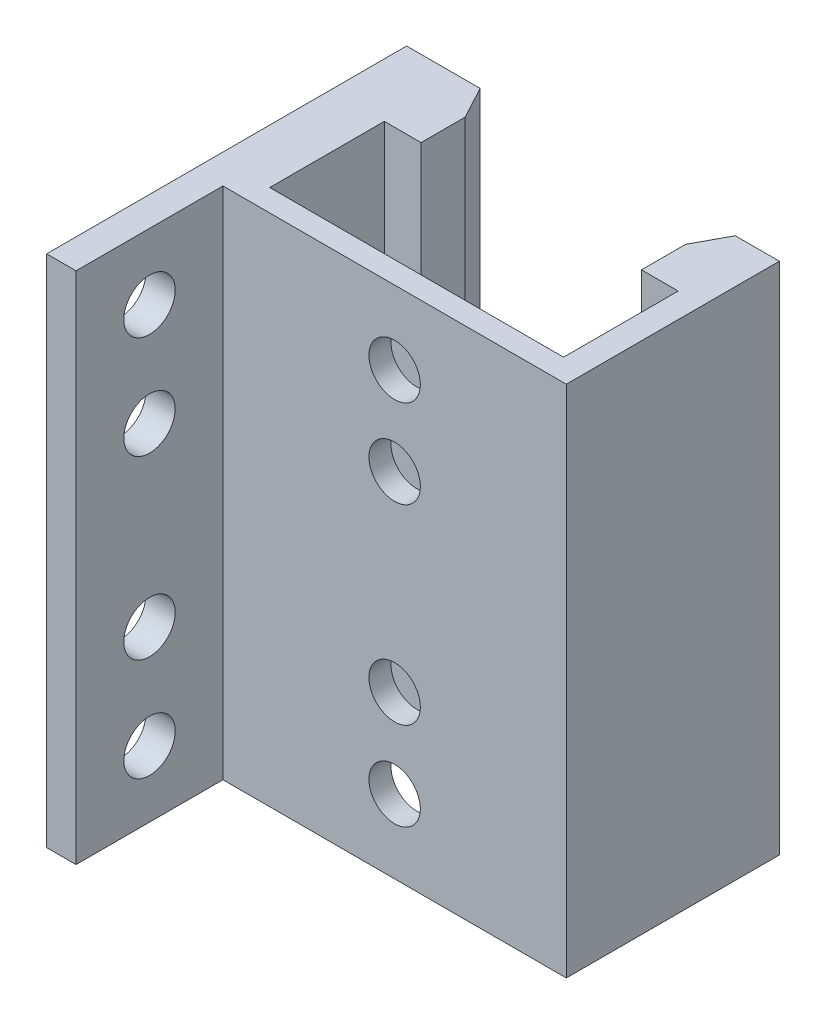
from build123d import *

# Parameters (mm, degrees)
BOSS_EXTRUDE1_DEPTH = 35
SKETCH2_R           = 1.75
CUT_EXTRUDE1_DEPTH  = 10
MOUNTING_WING_DEPTH = 2
SKETCH5_R           = 1.75
CUT_EXTRUDE2_DEPTH  = 3.5


with BuildPart() as part:
    # Sketch1 → Boss-Extrude1 (new body)
    with BuildSketch(Plane(origin=(0, 0, 0), x_dir=(1, 0, 0), z_dir=(0, 1, 0))):
        Polygon((-11.683800623, 0), (11.683800623, 0), (11.683800623, 14.5), (8.683800623, 14.5), (7.5, 12.3), (7.5, 9.3), (10, 9.3), (10, 1.5), (-10, 1.5), (-10, 9.3), (-7.5, 9.3), (-7.5, 12.3), (-8.683800623, 14.5), (-11.683800623, 14.5), align=None)
    extrude(amount=BOSS_EXTRUDE1_DEPTH)

    # Sketch2 → Cut-Extrude1 (cut)
    with BuildSketch(Plane.XY):
        with Locations((0, 5)):
            Circle(SKETCH2_R)
        with Locations((0, 24)):
            Circle(SKETCH2_R)
        with Locations((0, 11)):
            Circle(SKETCH2_R)
        with Locations((0, 30)):
            Circle(SKETCH2_R)
    extrude(amount=-CUT_EXTRUDE1_DEPTH, mode=Mode.SUBTRACT)

    # Optical Mount → Mounting Wing (add)
    with BuildSketch(Plane.ZY.offset(11.683800623)):
        Polygon((0, 0), (10, 0), (10, 35), (0, 35), (-14.5, 35), (-14.5, 0), align=None)
    extrude(amount=MOUNTING_WING_DEPTH)

    # Sketch5 → Cut-Extrude2 (cut)
    with BuildSketch(Plane(origin=(-11.683800623, 0, 0), x_dir=(0, 0, -1), z_dir=(1, 0, 0))):
        with Locations((-5, 4.5)):
            Circle(SKETCH5_R)
        with Locations((-5, 11.5)):
            Circle(SKETCH5_R)
        with Locations((-5, 23.5)):
            Circle(SKETCH5_R)
        with Locations((-5, 30.5)):
            Circle(SKETCH5_R)
    extrude(amount=-CUT_EXTRUDE2_DEPTH, mode=Mode.SUBTRACT)


solid = part.part
